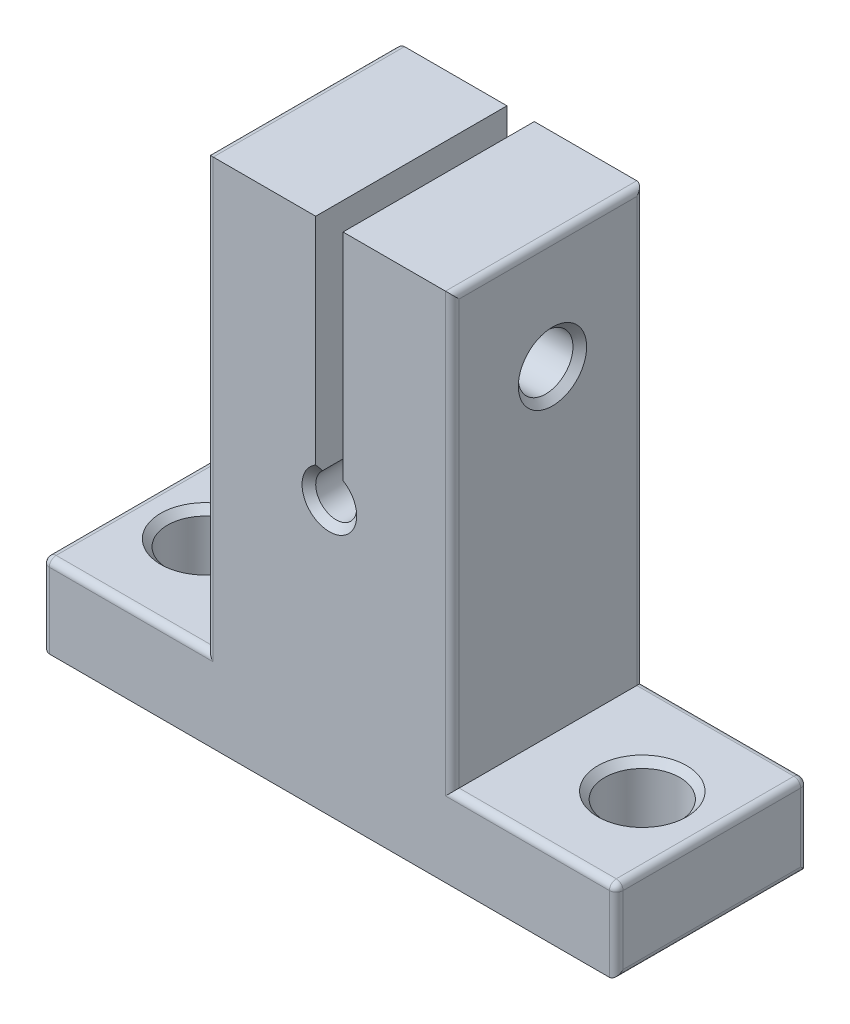
from build123d import *

# Parameters (mm, degrees)
BOSS_EXTRUDE1_DEPTH     = 7
SKETCH2_R               = 2.75
CUT_EXTRUDE1_DEPTH      = 39.5
CUT_EXTRUDE2_DEPTH      = 42.512046444
CUT_EXTRUDE2_DEPTH_BACK = 42.512046444
SKETCH5_R               = 2
CHAMFER2_SIZE           = 0.5
FILLET2_R               = 0.5


with BuildPart() as part:
    # Sketch1 → Boss-Extrude1 (new, symmetric)
    with BuildSketch(Plane.XY):
        with BuildLine():
            Line((-21, -3), (-21, 3))
            Line((-21, 3), (-9, 3))
            Line((-9, 3), (-9, 34.5))
            Line((-9, 34.5), (-1, 34.5))
            Line((-1, 34.5), (-1, 18.118033989))
            ThreePointArc((-1, 18.118033989), (0, 15.5), (1, 18.118033989))
            Line((1, 18.118033989), (1, 34.5))
            Line((1, 34.5), (9, 34.5))
            Line((9, 34.5), (9, 3))
            Line((9, 3), (21, 3))
            Line((21, 3), (21, -3))
            Line((21, -3), (-21, -3))
        make_face()
    extrude(amount=BOSS_EXTRUDE1_DEPTH, both=True)

    # Sketch2 → Cut-Extrude1 (cut, through all)
    with BuildSketch(Plane(origin=(0, 3, 0), x_dir=(1, 0, 0), z_dir=(0, 1, 0))):
        with Locations(Location((15.904501915, 0, 0), (0, 0, 180))):
            Circle(SKETCH2_R)
        with Locations((-16.095498085, 0)):
            Circle(SKETCH2_R)
    extrude(amount=-CUT_EXTRUDE1_DEPTH, mode=Mode.SUBTRACT)

    # Sketch5 → Cut-Extrude2 (cut, two sides: drawn at the far end of the back side and taken through both)
    with BuildSketch(Plane(origin=(-1, 0, 0), x_dir=(0, 0, -1), z_dir=(1, 0, 0)).offset(-CUT_EXTRUDE2_DEPTH_BACK)):
        with Locations((0.330734984, 26.309016994)):
            Circle(SKETCH5_R)
    extrude(amount=CUT_EXTRUDE2_DEPTH + CUT_EXTRUDE2_DEPTH_BACK, mode=Mode.SUBTRACT)

    # Chamfer2
    chamfer2_edges = [part.edges().sort_by_distance(p)[0] for p in [
        (0, 15.5, -7),
        (0, 15.5, 7),
        (18.654501915, 3, 0),
        (-18.845498085, 3, 0),
        (-9, 26.309016994, 1.669265016),
        (9, 26.309016994, 1.669265016),
    ]]
    chamfer(chamfer2_edges, length=CHAMFER2_SIZE)

    # Fillet2
    fillet2_edges = [part.edges().sort_by_distance(p)[0] for p in [
        (-15, 3, 7),
        (9, 18.75, -7),
        (15, 3, -7),
        (-21, 0, 7),
        (21, 0, -7),
        (-21, 0, -7),
        (-15, 3, -7),
        (-9, 18.75, -7),
        (21, 0, 7),
        (9, 34.5, 0),
        (21, 3, 0),
        (21, -3, 0),
        (-21, -3, 0),
        (-21, 3, 0),
        (-9, 34.5, 0),
        (15, 3, 7),
        (9, 18.75, 7),
        (-9, 18.75, 7),
    ]]
    fillet(fillet2_edges, radius=FILLET2_R)


solid = part.part
